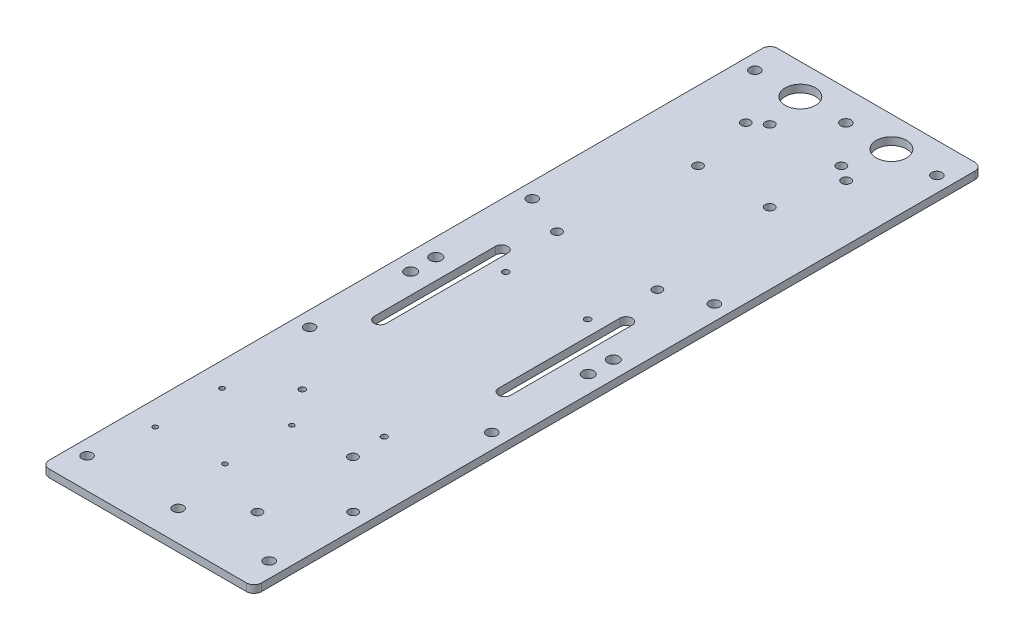
from build123d import *

# Parameters (mm, degrees)
PLATE_THICKNESS_DEPTH        = 3.175
SKETCH3_R                    = 2.159
MOUNTING_HOLES_DEPTH         = 159.781746826
SKETCH4_R                    = 1.905
JETSON_HOLES_W_O_MOUNT_DEPTH = 159.781746826
SKETCH5_R                    = 1.905
PDB_HOLES_DEPTH              = 159.781746826
SKETCH7_R                    = 1.27
PIXHAWK_HOLES_DEPTH          = 159.781746826
BATTERY_HOLES_DEPTH          = 159.781746826
VENTRAL_CAMERA_HOLES_REACH   = 160.782
SKETCH10_R                   = 1
SKETCH12_R                   = 6.35
WIFI_ANTENNA_HOLES_DEPTH     = 159.781746826
SKETCH6_R                    = 1.905
TERARANGER_HOLES_DEPTH       = 159.781746826
SKETCH14_R                   = 2.38125
SONARHOLES_DEPTH             = 159.781746826


with BuildPart() as part:
    # Sketch2 → Plate Thickness (new body)
    with BuildSketch(Plane(origin=(0, 0, 0), x_dir=(1, 0, 0), z_dir=(0, 1, 0))):
        with BuildLine():
            Line((-41.275, 152.4), (41.275, 152.4))
            ThreePointArc((41.275, 152.4), (43.52006403, 151.47006403), (44.45, 149.225))
            Line((44.45, 149.225), (44.45, -149.225))
            ThreePointArc((44.45, -149.225), (43.52006403, -151.47006403), (41.275, -152.4))
            Line((41.275, -152.4), (-41.275, -152.4))
            ThreePointArc((-41.275, -152.4), (-43.52006403, -151.47006403), (-44.45, -149.225))
            Line((-44.45, -149.225), (-44.45, 149.225))
            ThreePointArc((-44.45, 149.225), (-43.52006403, 151.47006403), (-41.275, 152.4))
        make_face()
    extrude(amount=PLATE_THICKNESS_DEPTH)

    # Sketch3 → Mounting holes (cut, through all)
    with BuildSketch(Plane(origin=(0, 3.175, 0), x_dir=(1, 0, 0), z_dir=(0, 1, 0))):
        with Locations(Location((-38.1, 139.7, 0), (0, 0, 270))):
            Circle(SKETCH3_R)
        with Locations(Location((-38.1, 46.566666666, 0), (0, 0, 270))):
            Circle(SKETCH3_R)
        with Locations(Location((-38.1, -46.56666582, 0), (0, 0, 90))):
            Circle(SKETCH3_R)
        with Locations(Location((-38.1, -139.7, 0), (0, 0, 90))):
            Circle(SKETCH3_R)
        with Locations(Location((38.1, -139.7, 0), (0, 0, 270))):
            Circle(SKETCH3_R)
        with Locations(Location((38.1, -46.56666582, 0), (0, 0, 270))):
            Circle(SKETCH3_R)
        with Locations(Location((38.1, 46.566666666, 0), (0, 0, 90))):
            Circle(SKETCH3_R)
        with Locations(Location((38.1, 139.7, 0), (0, 0, 90))):
            Circle(SKETCH3_R)
        with Locations(Location((0, 139.7, 0), (0, 0, 270))):
            Circle(SKETCH3_R)
        with Locations(Location((0, -139.7, 0), (0, 0, 90))):
            Circle(SKETCH3_R)
    extrude(amount=-MOUNTING_HOLES_DEPTH, mode=Mode.SUBTRACT)

    # Sketch4 → Jetson Holes (w/o mount) (cut, through all)
    with BuildSketch(Plane(origin=(0, 3.175, 0), x_dir=(1, 0, 0), z_dir=(0, 1, 0))):
        with Locations(Location((-21.0058, 118.808268359, 0), (0, 0, 270))):
            Circle(SKETCH4_R)
        with Locations(Location((-21.0058, 39.814268359, 0), (0, 0, 270))):
            Circle(SKETCH4_R)
        with Locations(Location((21.0058, 39.814268359, 0), (0, 0, 90))):
            Circle(SKETCH4_R)
        with Locations(Location((21.0058, 118.808268359, 0), (0, 0, 90))):
            Circle(SKETCH4_R)
    extrude(amount=-JETSON_HOLES_W_O_MOUNT_DEPTH, mode=Mode.SUBTRACT)

    # Sketch5 → PDB holes (cut, through all)
    with BuildSketch(Plane(origin=(0, 3.175, 0), x_dir=(1, 0, 0), z_dir=(0, 1, 0))):
        with Locations(Location((-15.378405846, 123.19, 0), (0, 0, 270))):
            Circle(SKETCH5_R)
        with Locations(Location((14.618994154, 123.19, 0), (0, 0, 270))):
            Circle(SKETCH5_R)
        with Locations(Location((14.618994154, 93.1926, 0), (0, 0, 270))):
            Circle(SKETCH5_R)
        with Locations(Location((-15.378405846, 93.1926, 0), (0, 0, 270))):
            Circle(SKETCH5_R)
    extrude(amount=-PDB_HOLES_DEPTH, mode=Mode.SUBTRACT)

    # Sketch7 → PixHawk Holes (cut, through all)
    with BuildSketch(Plane(origin=(0, 3.175, 0), x_dir=(1, 0, 0), z_dir=(0, 1, 0))):
        with Locations(Location((-17.145, 14.489268954, 0), (0, 0, 270))):
            Circle(SKETCH7_R)
        with Locations(Location((-17.145, -70.600731046, 0), (0, 0, 270))):
            Circle(SKETCH7_R)
        with Locations(Location((17.145, -70.600731046, 0), (0, 0, 270))):
            Circle(SKETCH7_R)
        with Locations(Location((17.145, 14.489268954, 0), (0, 0, 270))):
            Circle(SKETCH7_R)
    extrude(amount=-PIXHAWK_HOLES_DEPTH, mode=Mode.SUBTRACT)

    # Sketch8 → Battery Holes (cut, through all)
    with BuildSketch(Plane(origin=(0, 3.175, 0), x_dir=(1, 0, 0), z_dir=(0, 1, 0))):
        with BuildLine():
            Line((-23.495, 21.689654687), (-23.495, -29.110345313))
            ThreePointArc((-23.495, -29.110345313), (-26.035, -31.650345313), (-28.575, -29.110345313))
            Line((-28.575, -29.110345313), (-28.575, 21.689654687))
            ThreePointArc((-28.575, 21.689654687), (-26.035, 24.229654687), (-23.495, 21.689654687))
        make_face()
        with BuildLine():
            Line((23.495, 21.689654687), (23.495, -29.110345313))
            ThreePointArc((23.495, -29.110345313), (26.035, -31.650345313), (28.575, -29.110345313))
            Line((28.575, -29.110345313), (28.575, 21.689654687))
            ThreePointArc((28.575, 21.689654687), (26.035, 24.229654687), (23.495, 21.689654687))
        make_face()
    extrude(amount=-BATTERY_HOLES_DEPTH, mode=Mode.SUBTRACT)

    # Sketch10 → Ventral Camera holes (cut, up to next)
    with BuildSketch(Plane(origin=(0, 3.175, 0), x_dir=(1, 0, 0), z_dir=(0, 1, 0)), mode=Mode.PRIVATE) as ventral_camera_holes_sk1:
        with Locations(Location((-34.315460092, -87.008641581, 0), (0, 0, 270))):
            Circle(SKETCH10_R)
    ventral_camera_holes_tool1 = extrude(ventral_camera_holes_sk1.sketch, amount=-VENTRAL_CAMERA_HOLES_REACH, mode=Mode.PRIVATE) & part.part
    # Sketch10 → Ventral Camera holes (cut, up to next)
    with BuildSketch(Plane(origin=(0, 3.175, 0), x_dir=(1, 0, 0), z_dir=(0, 1, 0)), mode=Mode.PRIVATE) as ventral_camera_holes_sk2:
        with Locations(Location((-34.29, -115.008630005, 0), (0, 0, 270))):
            Circle(SKETCH10_R)
    ventral_camera_holes_tool2 = extrude(ventral_camera_holes_sk2.sketch, amount=-VENTRAL_CAMERA_HOLES_REACH, mode=Mode.PRIVATE) & part.part
    # Sketch10 → Ventral Camera holes (cut, up to next)
    with BuildSketch(Plane(origin=(0, 3.175, 0), x_dir=(1, 0, 0), z_dir=(0, 1, 0)), mode=Mode.PRIVATE) as ventral_camera_holes_sk3:
        with Locations(Location((-6.316568972, -85.789139736, 0), (0, 0, 270))):
            Circle(SKETCH10_R)
    ventral_camera_holes_tool3 = extrude(ventral_camera_holes_sk3.sketch, amount=-VENTRAL_CAMERA_HOLES_REACH, mode=Mode.PRIVATE) & part.part
    # Sketch10 → Ventral Camera holes (cut, up to next)
    with BuildSketch(Plane(origin=(0, 3.175, 0), x_dir=(1, 0, 0), z_dir=(0, 1, 0)), mode=Mode.PRIVATE) as ventral_camera_holes_sk4:
        with Locations(Location((-6.316568972, -113.789139736, 0), (0, 0, 270))):
            Circle(SKETCH10_R)
    ventral_camera_holes_tool4 = extrude(ventral_camera_holes_sk4.sketch, amount=-VENTRAL_CAMERA_HOLES_REACH, mode=Mode.PRIVATE) & part.part
    add(ventral_camera_holes_tool1.solids().sort_by_distance((-34.31546, 3.175, 87.008642))[0], mode=Mode.SUBTRACT)
    add(ventral_camera_holes_tool2.solids().sort_by_distance((-34.29, 3.175, 115.00863))[0], mode=Mode.SUBTRACT)
    add(ventral_camera_holes_tool3.solids().sort_by_distance((-6.316569, 3.175, 85.78914))[0], mode=Mode.SUBTRACT)
    add(ventral_camera_holes_tool4.solids().sort_by_distance((-6.316569, 3.175, 113.78914))[0], mode=Mode.SUBTRACT)

    # Sketch12 → Wifi antenna holes (cut, through all)
    with BuildSketch(Plane(origin=(0, 3.175, 0), x_dir=(1, 0, 0), z_dir=(0, 1, 0))):
        with Locations(Location((-19.05, 139.7, 0), (0, 0, 270))):
            Circle(SKETCH12_R)
        with Locations(Location((19.05, 139.7, 0), (0, 0, 270))):
            Circle(SKETCH12_R)
    extrude(amount=-WIFI_ANTENNA_HOLES_DEPTH, mode=Mode.SUBTRACT)

    # Sketch6 → TeraRanger Holes (cut, through all)
    with BuildSketch(Plane(origin=(0, 3.175, 0), x_dir=(1, 0, 0), z_dir=(0, 1, 0))):
        with Locations(Location((37.917522463, -104.394, 0), (0, 0, 270))):
            Circle(SKETCH6_R)
        with Locations(Location((17.917522463, -84.46, 0), (0, 0, 270))):
            Circle(SKETCH6_R)
        with Locations(Location((17.917522463, -124.46, 0), (0, 0, 270))):
            Circle(SKETCH6_R)
    extrude(amount=-TERARANGER_HOLES_DEPTH, mode=Mode.SUBTRACT)

    # Sketch14 → Sonarholes (cut, through all)
    with BuildSketch(Plane(origin=(0, 3.175, 0), x_dir=(1, 0, 0), z_dir=(0, 1, 0))):
        with Locations(Location((-37.138013211, 5.246249985, 0), (0, 0, 270))):
            Circle(SKETCH14_R)
        with Locations(Location((-37.138013211, -5.246249985, 0), (0, 0, 90))):
            Circle(SKETCH14_R)
        with Locations(Location((37.138013211, -5.246249985, 0), (0, 0, 270))):
            Circle(SKETCH14_R)
        with Locations(Location((37.138013211, 5.246249985, 0), (0, 0, 90))):
            Circle(SKETCH14_R)
    extrude(amount=-SONARHOLES_DEPTH, mode=Mode.SUBTRACT)


solid = part.part
